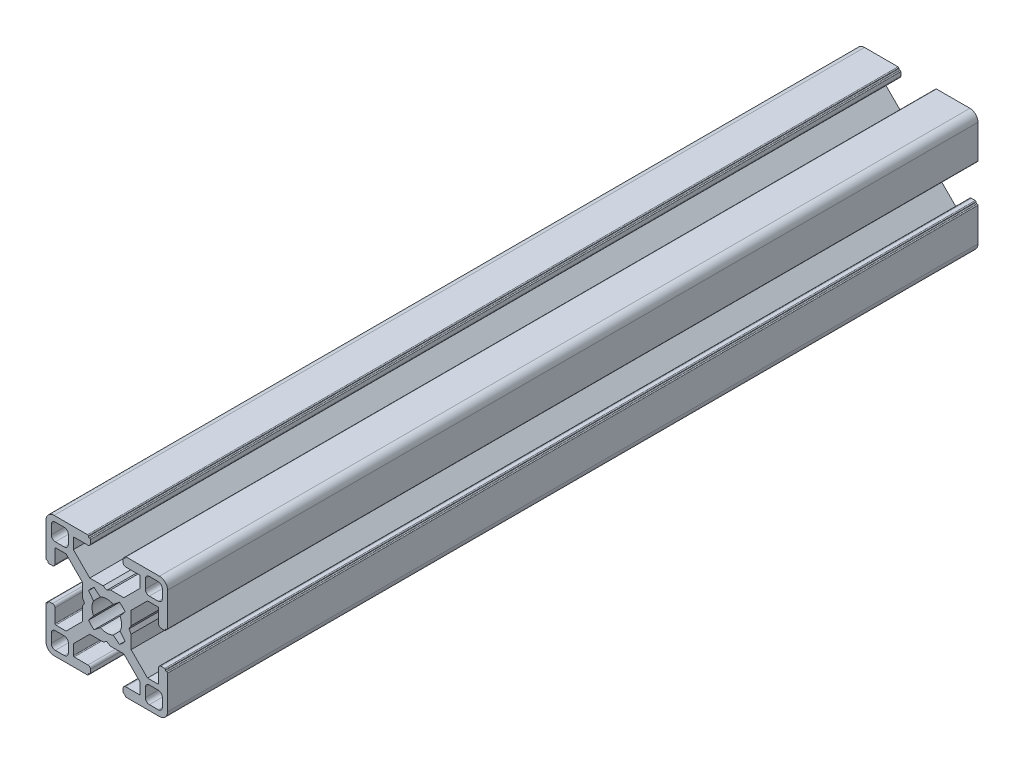
from build123d import *

# Parameters (mm, degrees)
DODANIE_WYCI_GNI_CIE1_DEPTH = 200


with BuildPart() as part:
    # Szkic1 → Dodanie-wyciągnięcie1 (new body)
    with BuildSketch(Plane.XY):
        with BuildLine():
            Line((96.56, 29.575148163), (97.459999946, 29.06))
            Line((97.459999946, 29.06), (100.764466193, 29.06))
            Line((100.764466193, 29.06), (104.810000327, 25.010000763))
            Line((104.810000327, 25.010000763), (104.810000327, 22.460001166))
            ThreePointArc((104.810000327, 22.460001166), (104.751421565, 22.318579525), (104.609999924, 22.260000763))
            Line((104.609999924, 22.260000763), (101.210000197, 22.260000763))
            ThreePointArc((101.210000197, 22.260000763), (100.785735989, 22.084264774), (100.61, 21.660000566))
            Line((100.61, 21.660000566), (100.61, 20.760000374))
            ThreePointArc((100.61, 20.760000374), (100.668578753, 20.618578753), (100.810000374, 20.56))
            Line((100.810000374, 20.56), (100.910000144, 20.56))
            ThreePointArc((100.910000144, 20.56), (101.05142109, 20.501421526), (101.109999564, 20.36000058))
            Line((101.109999564, 20.36000058), (101.109999564, 20.260000381))
            ThreePointArc((101.109999564, 20.260000381), (101.16857832, 20.118578755), (101.309999945, 20.06))
            Line((101.309999945, 20.06), (109.560000346, 20.06))
            ThreePointArc((109.560000346, 20.06), (110.974213664, 20.645786336), (111.56, 22.059999654))
            Line((111.56, 22.059999654), (111.56, 30.310000479))
            ThreePointArc((111.56, 30.310000479), (111.501421273, 30.451422036), (111.359999716, 30.510000763))
            Line((111.359999716, 30.510000763), (111.260000611, 30.510000763))
            ThreePointArc((111.260000611, 30.510000763), (111.118579054, 30.56857949), (111.060000327, 30.710001047))
            Line((111.060000327, 30.710001047), (111.060000327, 30.810000479))
            ThreePointArc((111.060000327, 30.810000479), (111.0014216, 30.951422036), (110.860000043, 31.010000763))
            Line((110.860000043, 31.010000763), (109.95999994, 31.010000763))
            ThreePointArc((109.95999994, 31.010000763), (109.535735606, 30.834264722), (109.359999564, 30.410000387))
            Line((109.359999564, 30.410000387), (109.359999564, 27.010000284))
            ThreePointArc((109.359999564, 27.010000284), (109.301420837, 26.868578727), (109.15999928, 26.81))
            Line((109.15999928, 26.81), (106.609999564, 26.81))
            Line((106.609999564, 26.81), (102.56446543, 30.855534134))
            Line((102.56446543, 30.855534134), (102.56446543, 34.160000381))
            Line((102.56446543, 34.160000381), (102.044852164, 35.06))
            Line((102.044852164, 35.06), (102.56446543, 35.959999619))
            Line((102.56446543, 35.959999619), (102.56446543, 39.264465866))
            Line((102.56446543, 39.264465866), (106.609999564, 43.31))
            Line((106.609999564, 43.31), (109.15999928, 43.31))
            ThreePointArc((109.15999928, 43.31), (109.301420837, 43.251421273), (109.359999564, 43.109999716))
            Line((109.359999564, 43.109999716), (109.359999564, 39.709999613))
            ThreePointArc((109.359999564, 39.709999613), (109.535735606, 39.285735278), (109.95999994, 39.109999237))
            Line((109.95999994, 39.109999237), (110.860000043, 39.109999237))
            ThreePointArc((110.860000043, 39.109999237), (111.0014216, 39.168577964), (111.060000327, 39.309999521))
            Line((111.060000327, 39.309999521), (111.060000327, 39.409998953))
            ThreePointArc((111.060000327, 39.409998953), (111.118579054, 39.55142051), (111.260000611, 39.609999237))
            Line((111.260000611, 39.609999237), (111.359999716, 39.609999237))
            ThreePointArc((111.359999716, 39.609999237), (111.501421273, 39.668577964), (111.56, 39.809999521))
            Line((111.56, 39.809999521), (111.56, 48.060000346))
            ThreePointArc((111.56, 48.060000346), (110.974213664, 49.474213664), (109.560000346, 50.06))
            Line((109.560000346, 50.06), (101.309999945, 50.06))
            ThreePointArc((101.309999945, 50.06), (101.16857832, 50.001421245), (101.109999564, 49.859999619))
            Line((101.109999564, 49.859999619), (101.109999564, 49.75999942))
            ThreePointArc((101.109999564, 49.75999942), (101.05142109, 49.618578474), (100.910000144, 49.56))
            Line((100.910000144, 49.56), (100.810000374, 49.56))
            ThreePointArc((100.810000374, 49.56), (100.668578753, 49.501421247), (100.61, 49.359999626))
            Line((100.61, 49.359999626), (100.61, 48.459999434))
            ThreePointArc((100.61, 48.459999434), (100.785735989, 48.035735226), (101.210000197, 47.859999237))
            Line((101.210000197, 47.859999237), (104.609999924, 47.859999237))
            ThreePointArc((104.609999924, 47.859999237), (104.751421565, 47.801420475), (104.810000327, 47.659998834))
            Line((104.810000327, 47.659998834), (104.810000327, 45.109999237))
            Line((104.810000327, 45.109999237), (100.764466193, 41.06))
            Line((100.764466193, 41.06), (97.459999946, 41.06))
            Line((97.459999946, 41.06), (96.56, 40.544851837))
            Line((96.56, 40.544851837), (95.660000054, 41.06))
            Line((95.660000054, 41.06), (92.355533807, 41.06))
            Line((92.355533807, 41.06), (88.309999673, 45.109999237))
            Line((88.309999673, 45.109999237), (88.309999673, 47.659998834))
            ThreePointArc((88.309999673, 47.659998834), (88.368578435, 47.801420475), (88.510000076, 47.859999237))
            Line((88.510000076, 47.859999237), (91.909999803, 47.859999237))
            ThreePointArc((91.909999803, 47.859999237), (92.334264011, 48.035735226), (92.51, 48.459999434))
            Line((92.51, 48.459999434), (92.51, 49.359999626))
            ThreePointArc((92.51, 49.359999626), (92.451421247, 49.501421247), (92.309999626, 49.56))
            Line((92.309999626, 49.56), (92.209999856, 49.56))
            ThreePointArc((92.209999856, 49.56), (92.06857891, 49.618578474), (92.010000436, 49.75999942))
            Line((92.010000436, 49.75999942), (92.010000436, 49.859999619))
            ThreePointArc((92.010000436, 49.859999619), (91.95142168, 50.001421245), (91.810000055, 50.06))
            Line((91.810000055, 50.06), (83.559999654, 50.06))
            ThreePointArc((83.559999654, 50.06), (82.145786336, 49.474213664), (81.56, 48.060000346))
            Line((81.56, 48.060000346), (81.56, 39.809999521))
            ThreePointArc((81.56, 39.809999521), (81.618578727, 39.668577964), (81.760000284, 39.609999237))
            Line((81.760000284, 39.609999237), (81.859999389, 39.609999237))
            ThreePointArc((81.859999389, 39.609999237), (82.001420946, 39.55142051), (82.059999673, 39.409998953))
            Line((82.059999673, 39.409998953), (82.059999673, 39.309999521))
            ThreePointArc((82.059999673, 39.309999521), (82.1185784, 39.168577964), (82.259999957, 39.109999237))
            Line((82.259999957, 39.109999237), (83.16000006, 39.109999237))
            ThreePointArc((83.16000006, 39.109999237), (83.584264394, 39.285735278), (83.760000436, 39.709999613))
            Line((83.760000436, 39.709999613), (83.760000436, 43.109999716))
            ThreePointArc((83.760000436, 43.109999716), (83.818579163, 43.251421273), (83.96000072, 43.31))
            Line((83.96000072, 43.31), (86.510000436, 43.31))
            Line((86.510000436, 43.31), (90.55553457, 39.264465866))
            Line((90.55553457, 39.264465866), (90.55553457, 35.959999619))
            Line((90.55553457, 35.959999619), (91.075147836, 35.06))
            Line((91.075147836, 35.06), (90.55553457, 34.160000381))
            Line((90.55553457, 34.160000381), (90.55553457, 30.855534134))
            Line((90.55553457, 30.855534134), (86.510000436, 26.81))
            Line((86.510000436, 26.81), (83.96000072, 26.81))
            ThreePointArc((83.96000072, 26.81), (83.818579163, 26.868578727), (83.760000436, 27.010000284))
            Line((83.760000436, 27.010000284), (83.760000436, 30.410000387))
            ThreePointArc((83.760000436, 30.410000387), (83.584264394, 30.834264722), (83.16000006, 31.010000763))
            Line((83.16000006, 31.010000763), (82.259999957, 31.010000763))
            ThreePointArc((82.259999957, 31.010000763), (82.1185784, 30.951422036), (82.059999673, 30.810000479))
            Line((82.059999673, 30.810000479), (82.059999673, 30.710001047))
            ThreePointArc((82.059999673, 30.710001047), (82.001420946, 30.56857949), (81.859999389, 30.510000763))
            Line((81.859999389, 30.510000763), (81.760000284, 30.510000763))
            ThreePointArc((81.760000284, 30.510000763), (81.618578727, 30.451422036), (81.56, 30.310000479))
            Line((81.56, 30.310000479), (81.56, 22.059999654))
            ThreePointArc((81.56, 22.059999654), (82.145786336, 20.645786336), (83.559999654, 20.06))
            Line((83.559999654, 20.06), (91.810000055, 20.06))
            ThreePointArc((91.810000055, 20.06), (91.95142168, 20.118578755), (92.010000436, 20.260000381))
            Line((92.010000436, 20.260000381), (92.010000436, 20.36000058))
            ThreePointArc((92.010000436, 20.36000058), (92.06857891, 20.501421526), (92.209999856, 20.56))
            Line((92.209999856, 20.56), (92.309999626, 20.56))
            ThreePointArc((92.309999626, 20.56), (92.451421247, 20.618578753), (92.51, 20.760000374))
            Line((92.51, 20.760000374), (92.51, 21.660000566))
            ThreePointArc((92.51, 21.660000566), (92.334264011, 22.084264774), (91.909999803, 22.260000763))
            Line((91.909999803, 22.260000763), (88.510000076, 22.260000763))
            ThreePointArc((88.510000076, 22.260000763), (88.368578435, 22.318579525), (88.309999673, 22.460001166))
            Line((88.309999673, 22.460001166), (88.309999673, 25.010000763))
            Line((88.309999673, 25.010000763), (92.355533807, 29.06))
            Line((92.355533807, 29.06), (95.660000054, 29.06))
            Line((95.660000054, 29.06), (96.56, 29.575148163))
        make_face()
        with BuildLine():
            Line((109.26000109, 48.760000398), (107.060000327, 48.760000398))
            ThreePointArc((107.060000327, 48.760000398), (106.352893543, 48.467107182), (106.060000327, 47.760000398))
            Line((106.060000327, 47.760000398), (106.060000327, 45.559999635))
            ThreePointArc((106.060000327, 45.559999635), (106.352893543, 44.852892851), (107.060000327, 44.559999635))
            Line((107.060000327, 44.559999635), (109.26000109, 44.559999635))
            ThreePointArc((109.26000109, 44.559999635), (109.967107874, 44.852892851), (110.26000109, 45.559999635))
            Line((110.26000109, 45.559999635), (110.26000109, 47.760000398))
            ThreePointArc((110.26000109, 47.760000398), (109.967107874, 48.467107182), (109.26000109, 48.760000398))
        make_face(mode=Mode.SUBTRACT)
        with BuildLine():
            Line((94.959870476, 38.340561767), (93.424070588, 39.578400903))
            ThreePointArc((93.424070588, 39.578400903), (92.678997741, 38.957155561), (92.054663108, 38.214669473))
            Line((92.054663108, 38.214669473), (93.279438268, 36.660129597))
            ThreePointArc((93.279438268, 36.660129597), (92.91, 35.06), (93.279438268, 33.459870403))
            Line((93.279438268, 33.459870403), (92.054663108, 31.905330527))
            ThreePointArc((92.054663108, 31.905330527), (92.678997741, 31.162844439), (93.424070588, 30.541599097))
            Line((93.424070588, 30.541599097), (94.959870476, 31.779438233))
            ThreePointArc((94.959870476, 31.779438233), (96.56, 31.41), (98.160129524, 31.779438233))
            Line((98.160129524, 31.779438233), (99.695929412, 30.541599097))
            ThreePointArc((99.695929412, 30.541599097), (100.441002259, 31.162844439), (101.065336892, 31.905330527))
            Line((101.065336892, 31.905330527), (99.840561732, 33.459870403))
            ThreePointArc((99.840561732, 33.459870403), (100.21, 35.06), (99.840561732, 36.660129597))
            Line((99.840561732, 36.660129597), (101.065336892, 38.214669473))
            ThreePointArc((101.065336892, 38.214669473), (100.441002259, 38.957155561), (99.695929412, 39.578400903))
            Line((99.695929412, 39.578400903), (98.160129524, 38.340561767))
            ThreePointArc((98.160129524, 38.340561767), (96.56, 38.71), (94.959870476, 38.340561767))
        make_face(mode=Mode.SUBTRACT)
        with BuildLine():
            Line((83.85999891, 21.359999602), (86.059999673, 21.359999602))
            ThreePointArc((86.059999673, 21.359999602), (86.767106457, 21.652892818), (87.059999673, 22.359999602))
            Line((87.059999673, 22.359999602), (87.059999673, 24.560000365))
            ThreePointArc((87.059999673, 24.560000365), (86.767106457, 25.267107149), (86.059999673, 25.560000365))
            Line((86.059999673, 25.560000365), (83.85999891, 25.560000365))
            ThreePointArc((83.85999891, 25.560000365), (83.152892126, 25.267107149), (82.85999891, 24.560000365))
            Line((82.85999891, 24.560000365), (82.85999891, 22.359999602))
            ThreePointArc((82.85999891, 22.359999602), (83.152892126, 21.652892818), (83.85999891, 21.359999602))
        make_face(mode=Mode.SUBTRACT)
        with BuildLine():
            Line((110.26000109, 22.359999602), (110.26000109, 24.560000365))
            ThreePointArc((110.26000109, 24.560000365), (109.967107874, 25.267107149), (109.26000109, 25.560000365))
            Line((109.26000109, 25.560000365), (107.060000327, 25.560000365))
            ThreePointArc((107.060000327, 25.560000365), (106.352893543, 25.267107149), (106.060000327, 24.560000365))
            Line((106.060000327, 24.560000365), (106.060000327, 22.359999602))
            ThreePointArc((106.060000327, 22.359999602), (106.352893543, 21.652892818), (107.060000327, 21.359999602))
            Line((107.060000327, 21.359999602), (109.26000109, 21.359999602))
            ThreePointArc((109.26000109, 21.359999602), (109.967107874, 21.652892818), (110.26000109, 22.359999602))
        make_face(mode=Mode.SUBTRACT)
        with BuildLine():
            Line((86.059999673, 48.760000398), (83.85999891, 48.760000398))
            ThreePointArc((83.85999891, 48.760000398), (83.152892126, 48.467107182), (82.85999891, 47.760000398))
            Line((82.85999891, 47.760000398), (82.85999891, 45.559999635))
            ThreePointArc((82.85999891, 45.559999635), (83.152892126, 44.852892851), (83.85999891, 44.559999635))
            Line((83.85999891, 44.559999635), (86.059999673, 44.559999635))
            ThreePointArc((86.059999673, 44.559999635), (86.767106457, 44.852892851), (87.059999673, 45.559999635))
            Line((87.059999673, 45.559999635), (87.059999673, 47.760000398))
            ThreePointArc((87.059999673, 47.760000398), (86.767106457, 48.467107182), (86.059999673, 48.760000398))
        make_face(mode=Mode.SUBTRACT)
    extrude(amount=DODANIE_WYCI_GNI_CIE1_DEPTH)


solid = part.part
